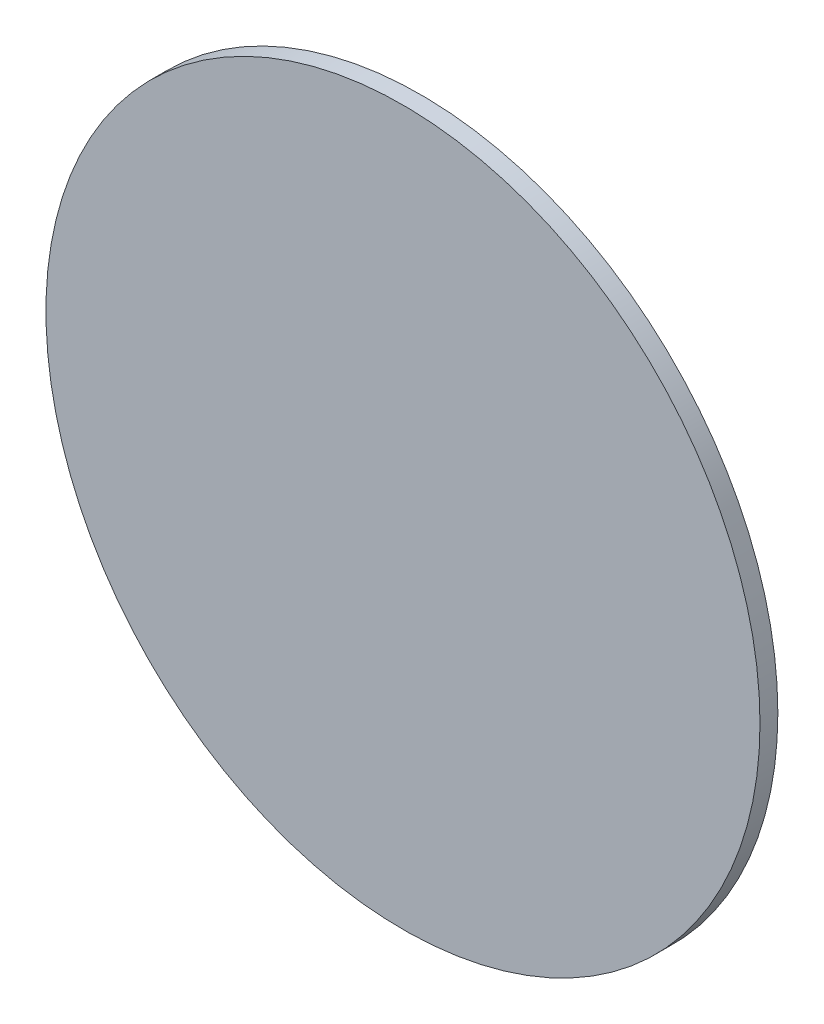
from build123d import *


with BuildPart() as part:
    # Эскиз2 → Повернуть1 (revolve)
    with BuildSketch(Plane(origin=(0, 0, 0), x_dir=(1, 0, 0), z_dir=(0, 1, 0))):
        with BuildLine():
            Line((0, 0), (60, 0))
            Line((60, 0), (60, 3))
            Line((60, 3), (30, 3))
            ThreePointArc((30, 3), (21.213203436, 24.213203436), (0, 33))
            Line((0, 33), (0, 0))
        make_face()
    revolve(axis=Axis((0, 0, 0), (0, 0, -1)))


solid = part.part
